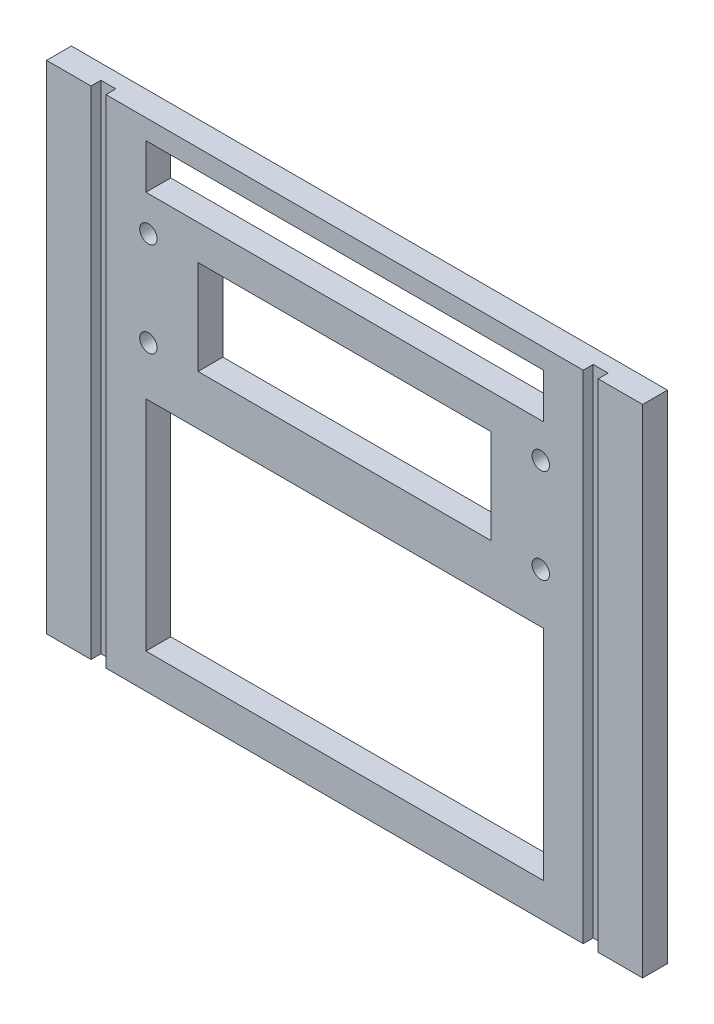
from build123d import *

# Parameters (mm, degrees)
SKETCH_1_W          = 120
SKETCH_1_H          = 100
EXTRUDE_1_DEPTH     = 5
SKETCH_2_W          = 3
SKETCH_2_H          = 100
CUT_EXTRUDE_1_DEPTH = 2
SKETCH_3_R          = 1.75
SKETCH_3_W          = 80
SKETCH_3_H          = 44
SKETCH_3_H_2        = 9
SKETCH_3_W_2        = 59
SKETCH_3_H_3        = 19
CUT_EXTRUDE_2_DEPTH = 157.284996081


with BuildPart() as part:
    # 草图1 → 凸台-拉伸1 (new body)
    with BuildSketch(Plane.XY):
        with Locations((60, 50)):
            Rectangle(SKETCH_1_W, SKETCH_1_H)
    extrude(amount=EXTRUDE_1_DEPTH)

    # 草图2 → 切除-拉伸1 (cut)
    with BuildSketch(Plane.XY.offset(5)):
        with Locations((10.45, 50)):
            Rectangle(SKETCH_2_W, SKETCH_2_H)
        with Locations((109.55, 50)):
            Rectangle(SKETCH_2_W, SKETCH_2_H)
    extrude(amount=-CUT_EXTRUDE_1_DEPTH, mode=Mode.SUBTRACT)

    # 草图3 → 切除-拉伸2 (cut, through all)
    with BuildSketch(Plane.XY.offset(5)):
        with Locations((20.5, 80)):
            Circle(SKETCH_3_R)
        with Locations((20.5, 61)):
            Circle(SKETCH_3_R)
        with Locations((99.5, 80)):
            Circle(SKETCH_3_R)
        with Locations((99.5, 61)):
            Circle(SKETCH_3_R)
        with Locations((60, 29)):
            Rectangle(SKETCH_3_W, SKETCH_3_H)
        with Locations((60, 91.5)):
            Rectangle(SKETCH_3_W, SKETCH_3_H_2)
        with Locations((60, 70.5)):
            Rectangle(SKETCH_3_W_2, SKETCH_3_H_3)
    extrude(amount=-CUT_EXTRUDE_2_DEPTH, mode=Mode.SUBTRACT)


solid = part.part
